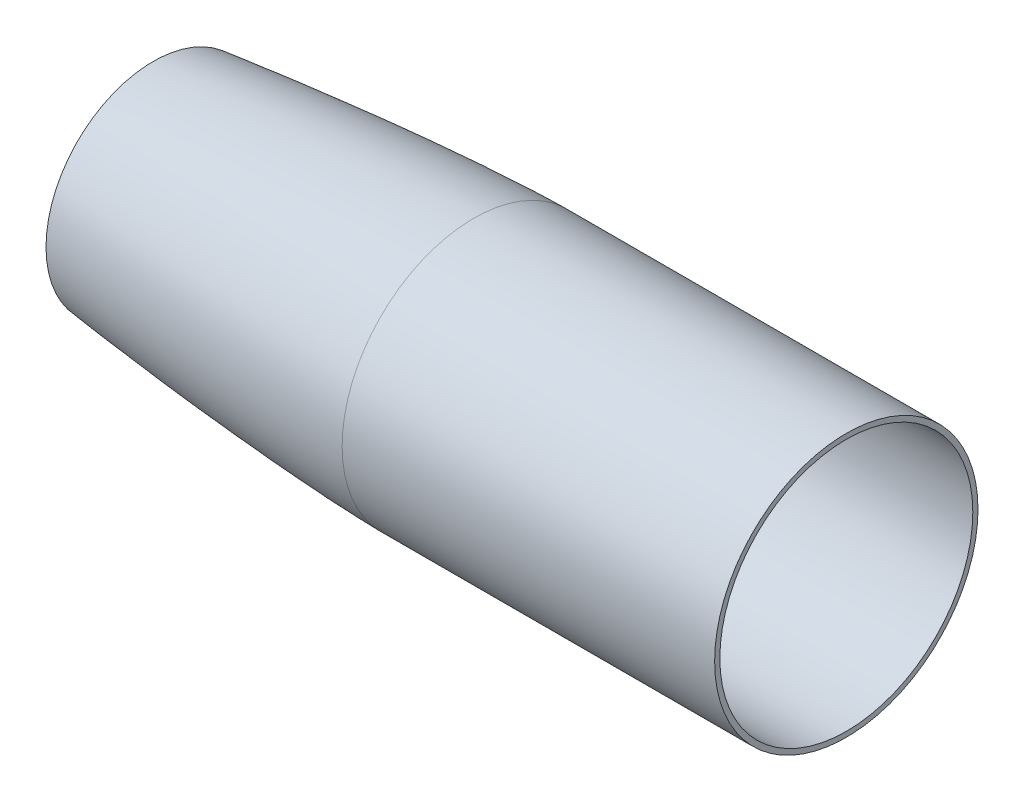
from build123d import *

# Parameters (mm, degrees)
SKETCH2_W               = 15
SKETCH2_H               = 3
CUT_EXTRUDE1_DEPTH      = 527.095998873
CUT_EXTRUDE1_DEPTH_BACK = 527.095998873
SKETCH3_W               = 60
SKETCH3_H               = 40
CUT_EXTRUDE4_DEPTH      = 200
CUT_EXTRUDE4_DEPTH_BACK = 200
SKETCH7_W               = 25.155677674
SKETCH7_H               = 116.957586973
CUT_EXTRUDE5_DEPTH      = 200
CUT_EXTRUDE5_DEPTH_BACK = 200
SKETCH10_W              = 81.753686474
SKETCH10_H              = 71.861814367
SKETCH10_H_2            = 66.111228802
SKETCH11_R              = 76
SKETCH11_R_2            = 73
BOSS_EXTRUDE1_DEPTH     = 200


with BuildPart() as part:
    # Sketch2 → Revolve1 (revolve)
    with BuildSketch(Plane.XY, mode=Mode.PRIVATE) as revolve1_sk:
        with BuildLine():
            add(Edge.make_bspline(
                [(0, 0), (0.003488157, 0.013783816), (0.01319051, 0.04033603), (0.042063455, 0.089619378), (0.103253354, 0.174781236), (0.195655925, 0.279068591), (0.312893359, 0.394476748), (0.444471001, 0.511330855), (0.626416713, 0.661995475), (0.905417524, 0.874340043), (1.39310301, 1.210288344), (2.271497179, 1.747935993), (3.81588258, 2.58108843), (6.629844229, 3.907734136), (11.732179856, 5.990626535), (20.21551767, 8.974782838), (31.724489027, 12.492116493), (45.606799288, 16.281172086), (64.651371321, 21.020860811), (87.658368898, 26.206631662), (114.722363422, 31.746320492), (145.854010301, 37.537896498), (177.066921726, 42.871807206), (208.345145014, 47.80723428), (239.678124678, 52.381191067), (271.058803785, 56.615153522), (302.482154914, 60.519680025), (330.011833268, 63.648418258), (353.631593101, 66.11894295), (373.329466343, 68.03013258), (389.09643856, 69.466784443), (404.87199461, 70.806129018), (418.683052253, 71.886996993), (430.526418849, 72.742662769), (440.399441684, 73.404435972), (448.299980017, 73.901071328), (455.214817724, 74.304775576), (461.143160456, 74.62677953), (466.084350078, 74.877801517), (470.037846817, 75.067577987), (476.005510657, 75.336303636), (481.736537174, 75.563352259), (487.230769759, 75.748085721), (492.488061525, 75.884662604), (495.116996281, 75.940348523), (497.370577281, 75.978043797), (498.87307617, 75.993594118), (499.624354134, 76), (500, 76)],
                knots=[0, 0, 0, 0, 0, 0.000111673, 0.000223346, 0.000446692, 0.000826683, 0.001206674, 0.00151955, 0.001832426, 0.00268779, 0.00396812, 0.006183448, 0.009942812, 0.016507085, 0.02846832, 0.049586633, 0.080772227, 0.111303184, 0.141834141, 0.204203935, 0.266574069, 0.32894426, 0.39131442, 0.453684463, 0.516054568, 0.578424701, 0.640794795, 0.703164955, 0.734350023, 0.765535092, 0.796720055, 0.827905019, 0.859090157, 0.874682727, 0.890275296, 0.905867787, 0.921460278, 0.929256523, 0.937052769, 0.944849014, 0.95264526, 0.97632263, 0.982241972, 0.988161315, 0.994080657, 0.997040329, 1, 1, 1, 1, 1], degree=4))
            Line((0, 0), (5.417953983, 0))
            add(Edge.make_bspline(
                [(5.417953983, 0), (5.487108618, 0.034056877), (6.008710879, 0.289194044), (7.109149759, 0.801724321), (9.332977209, 1.766377761), (12.323858805, 2.950685774), (15.979259037, 4.284137308), (19.675237412, 5.547428931), (24.644660852, 7.159251815), (30.908509069, 9.060376022), (38.481817212, 11.207101646), (48.630728592, 13.927744802), (61.390794469, 17.109248907), (76.777682749, 20.670150662), (92.21957601, 24.023267405), (107.703561132, 27.204013148), (128.394086795, 31.244920878), (154.327525342, 35.965408795), (185.530660988, 41.190734583), (216.800212994, 46.028750173), (258.5666461, 52.005891763), (310.892971562, 58.639458433), (363.34454376, 64.182605862), (405.368729998, 67.884379641), (431.657472473, 69.852194461), (452.699458369, 71.174329189), (468.485172815, 72.018357182), (481.638890805, 72.572899611), (490.843500267, 72.848246709), (495.435669889, 72.947250254), (498.061971579, 72.985030833), (499.352045651, 73), (500, 73)],
                knots=[0.009734779, 0.009734779, 0.009734779, 0.009734779, 0.01022223, 0.013399013, 0.017298621, 0.025097839, 0.032897056, 0.040696273, 0.048495491, 0.064093925, 0.07969236, 0.095290794, 0.126487664, 0.157684533, 0.188881402, 0.220078271, 0.25127514, 0.313668879, 0.376062617, 0.438456355, 0.500850093, 0.62563757, 0.750425047, 0.812818785, 0.875212523, 0.906409393, 0.937606262, 0.968803131, 0.984401565, 0.992200783, 0.996100391, 1, 1, 1, 1], degree=3))
            Line((500, 73), (500, 76))
        make_face()
        with Locations((507.5, 74.5)):
            Rectangle(SKETCH2_W, SKETCH2_H)
    revolve(revolve1_sk.sketch.rotate(Axis((0, 0, 0), (1, 0, 0)), 90), axis=Axis((0, 0, 0), (1, 0, 0)))

    # Sketch3 → Cut-Extrude1 (cut, two sides: drawn at the far end of the back side and taken through both)
    with BuildSketch(Plane.XY.offset(-CUT_EXTRUDE1_DEPTH_BACK)):
        Rectangle(SKETCH3_W, SKETCH3_H)
    extrude(amount=CUT_EXTRUDE1_DEPTH + CUT_EXTRUDE1_DEPTH_BACK, mode=Mode.SUBTRACT)

    # Sketch7 → Cut-Extrude4 (cut, two sides: drawn at the far end of the back side and taken through both)
    with BuildSketch(Plane.XY.offset(-CUT_EXTRUDE4_DEPTH_BACK)):
        with Locations((23.819627951, -5.478793487)):
            Rectangle(SKETCH7_W, SKETCH7_H)
        Polygon((36.397466788, 53), (244.628505212, 53), (244.628505212, 0), (244.628505212, -63.957586973), (36.397466788, -63.957586973), align=None)
    extrude(amount=CUT_EXTRUDE4_DEPTH + CUT_EXTRUDE4_DEPTH_BACK, mode=Mode.SUBTRACT)

    # Sketch10 → Cut-Extrude5 (cut, two sides: drawn at the far end of the back side and taken through both)
    with BuildSketch(Plane.XY.offset(-CUT_EXTRUDE5_DEPTH_BACK)):
        with Locations((274.123156763, 35.930907184)):
            Rectangle(SKETCH10_W, SKETCH10_H)
        with Locations((274.123156763, -33.055614401)):
            Rectangle(SKETCH10_W, SKETCH10_H_2)
    extrude(amount=CUT_EXTRUDE5_DEPTH + CUT_EXTRUDE5_DEPTH_BACK, mode=Mode.SUBTRACT)

    # Sketch11 → Boss-Extrude1 (add)
    with BuildSketch(Plane(origin=(515, 0, 0), x_dir=(0, 0, -1), z_dir=(1, 0, 0))):
        with Locations(Location((0, 0, 0), (0, 0, 180))):
            Circle(SKETCH11_R)
        with Locations(Location((0, 0, 0), (0, 0, 180))):
            Circle(SKETCH11_R_2, mode=Mode.SUBTRACT)
    extrude(amount=BOSS_EXTRUDE1_DEPTH)


solid = part.part
